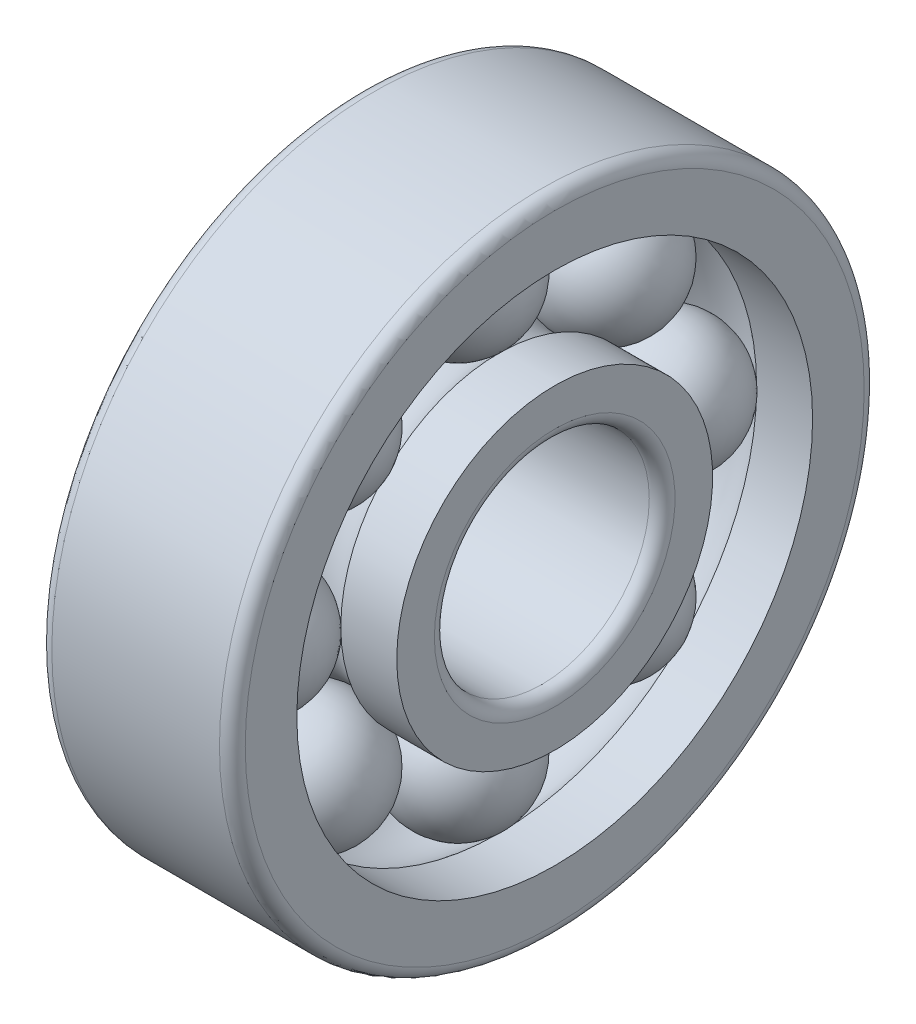
from build123d import *

# Parameters (mm, degrees)
FILLET1_R          = 0.6
FILLET2_R          = 0.6
CIRPATTERN2_COUNT  = 8
CUT_EXTRUDE1_DEPTH = 0.3


with BuildPart() as part:
    # Sketch1 → Revolve1 (revolve)
    with BuildSketch(Plane.XY, mode=Mode.PRIVATE) as revolve1_sk:
        with BuildLine():
            Line((0, 12), (2.604116301, 12))
            ThreePointArc((2.604116301, 12), (4.5, 12.675), (6.395883699, 12))
            Line((6.395883699, 12), (9, 12))
            Line((9, 12), (9, 15))
            Line((9, 15), (0, 15))
            Line((0, 15), (0, 12))
        make_face()
        with BuildLine():
            Line((0, 5), (9, 5))
            Line((9, 5), (9, 7.35))
            Line((9, 7.35), (6.395883699, 7.35))
            ThreePointArc((6.395883699, 7.35), (4.5, 6.675), (2.604116301, 7.35))
            Line((2.604116301, 7.35), (0, 7.35))
            Line((0, 7.35), (0, 5))
        make_face()
    revolve(revolve1_sk.sketch.rotate(Axis((0, 0, 0), (1, 0, 0)), 90), axis=Axis((0, 0, 0), (1, 0, 0)))

    # Fillet1
    fillet1_edges = [part.edges().sort_by_distance(p)[0] for p in [
        (0, 0, -15),
        (9, 0, -15),
    ]]
    fillet(fillet1_edges, radius=FILLET1_R)

    # Fillet2
    fillet2_edges = [part.edges().sort_by_distance(p)[0] for p in [
        (9, 0, -5),
        (0, 0, -5),
    ]]
    fillet(fillet2_edges, radius=FILLET2_R)

    # Sketch3 → Cut-Extrude1 (cut)
    # profile 1 of 7: a face of its own
    with BuildSketch(Plane.ZY):
        Polygon((-3.719151818, 11.718675946), (-4.129764642, 13.169061498), (-3.327410746, 13.396131303), (-3.279013831, 13.224763608), (-3.924001655, 13.042133738), (-3.796769513, 12.593168641), (-3.238835259, 12.751143478), (-3.190438344, 12.580080167), (-3.748372597, 12.422105329), (-3.561785746, 11.763115881), align=None)
    # profile 2 of 7: a face of its own
    with BuildSketch(Plane.ZY):
        Polygon((-2.850834983, 11.965266385), (-2.664248133, 13.531317521), (-2.491967289, 13.563886515), (-1.716399107, 12.179552099), (-1.899942126, 12.144852424), (-2.125794399, 12.566118658), (-2.631983522, 12.470237976), (-2.680380438, 11.997530995), align=None)
        with BuildLine():
            Line((-2.615546834, 12.638257456), (-2.205238392, 12.715875151))
            Line((-2.205238392, 12.715875151), (-2.408566315, 13.10152856))
            add(Edge.make_bspline(
                [(-2.408566315, 13.10152856), (-2.416215139, 13.115915535), (-2.431149278, 13.144005744), (-2.452328841, 13.185420297), (-2.472416903, 13.224685888), (-2.49142099, 13.26180545), (-2.5087066, 13.297048483), (-2.524559114, 13.330365638), (-2.539202471, 13.361556616), (-2.548209714, 13.381850383), (-2.552539529, 13.391605671)],
                knots=[0, 0, 0, 0, 1.207278304, 2.357180626, 3.446533966, 4.475345549, 5.447003446, 6.354914621, 7.209201469, 8, 8, 8, 8], degree=3))
            add(Edge.make_bspline(
                [(-2.552539529, 13.391605671), (-2.55216247, 13.367153081), (-2.551408249, 13.318241168), (-2.553416017, 13.244743634), (-2.557518329, 13.171030702), (-2.562310793, 13.121908532), (-2.564714854, 13.097267196)],
                knots=[0, 0, 0, 0, 0.99540698, 1.991088116, 2.992262153, 4, 4, 4, 4], degree=3))
            Line((-2.564714854, 13.097267196), (-2.615546834, 12.638257456))
        make_face(mode=Mode.SUBTRACT)
    # profile 3 of 7: a face of its own
    with BuildSketch(Plane.ZY):
        with BuildLine():
            Line((-1.053862581, 12.831370346), (-1.069081736, 13.007912554))
            Line((-1.069081736, 13.007912554), (-0.546151542, 13.054178788))
            Line((-0.546151542, 13.054178788), (-0.498363392, 12.495331385))
            add(Edge.make_bspline(
                [(-0.498363392, 12.495331385), (-0.516707407, 12.474927442), (-0.552486208, 12.435130883), (-0.610444028, 12.381987937), (-0.669772023, 12.335759629), (-0.73088098, 12.296834431), (-0.79356108, 12.265190888), (-0.857843247, 12.24105905), (-0.923645284, 12.223781215), (-0.968443541, 12.218533179), (-0.990855275, 12.215907684)],
                knots=[0, 0, 0, 0, 1.132945652, 2.209736461, 3.243482532, 4.236513735, 5.198131396, 6.138569381, 7.068760867, 8, 8, 8, 8], degree=3))
            add(Edge.make_bspline(
                [(-0.990855275, 12.215907684), (-1.005762872, 12.214873601), (-1.035253658, 12.212827939), (-1.079089741, 12.21366584), (-1.121918554, 12.216857657), (-1.163838656, 12.223305282), (-1.204799256, 12.232775907), (-1.244869165, 12.244838427), (-1.283678903, 12.260374583), (-1.32172534, 12.278054885), (-1.358243788, 12.299236255), (-1.393328769, 12.322918511), (-1.42661211, 12.349594405), (-1.458323985, 12.378904927), (-1.488519327, 12.41086573), (-1.5168489, 12.445766586), (-1.543636314, 12.483304212), (-1.568974179, 12.523421969), (-1.59199352, 12.566267587), (-1.612762482, 12.611632114), (-1.63135294, 12.659238812), (-1.64709682, 12.709546378), (-1.660791326, 12.762049377), (-1.672008441, 12.817020963), (-1.680932799, 12.874306535), (-1.684738395, 12.913429061), (-1.686675081, 12.93333869)],
                knots=[0, 0, 0, 0, 0.95729573, 1.893759506, 2.806928323, 3.708188722, 4.608885951, 5.499551386, 6.387077985, 7.28589543, 8.186005648, 9.089585416, 9.996458285, 10.916799269, 11.855202595, 12.811879746, 13.795320432, 14.809245548, 15.850818141, 16.909922757, 18.005180354, 19.123928844, 20.286311769, 21.481250689, 22.718197129, 24, 24, 24, 24], degree=3))
            add(Edge.make_bspline(
                [(-1.686675081, 12.93333869), (-1.688222965, 12.953620411), (-1.691261594, 12.993435138), (-1.69184155, 13.052460451), (-1.690664526, 13.109766203), (-1.685872816, 13.165307101), (-1.679140045, 13.219122167), (-1.668929394, 13.27101953), (-1.656234735, 13.321251478), (-1.64073581, 13.369629408), (-1.622756062, 13.415538874), (-1.603496518, 13.459058314), (-1.581583187, 13.499335992), (-1.558478881, 13.537110473), (-1.532850551, 13.571694223), (-1.505927472, 13.603738466), (-1.476932448, 13.632800711), (-1.445899127, 13.658726633), (-1.413302324, 13.682390997), (-1.378564257, 13.702960245), (-1.342120478, 13.721030784), (-1.304033258, 13.736469885), (-1.264245235, 13.7497643), (-1.222590534, 13.759954877), (-1.17916277, 13.767653899), (-1.149564839, 13.770680525), (-1.134524107, 13.77221856)],
                knots=[0, 0, 0, 0, 1.294601443, 2.541411641, 3.756203764, 4.942233883, 6.088750408, 7.207342046, 8.307125532, 9.385705967, 10.438901258, 11.444989272, 12.41314181, 13.355967366, 14.261617054, 15.15071446, 16.018533511, 16.871220098, 17.722731511, 18.580151351, 19.438106304, 20.310146009, 21.194608931, 22.106388259, 23.037726373, 24, 24, 24, 24], degree=3))
            add(Edge.make_bspline(
                [(-1.134524107, 13.77221856), (-1.112511146, 13.7736572), (-1.069671997, 13.77645692), (-1.006984145, 13.771822033), (-0.947909935, 13.761532747), (-0.89284246, 13.743673544), (-0.841722619, 13.719637874), (-0.794129005, 13.690598634), (-0.751324404, 13.654882612), (-0.718533682, 13.621320947), (-0.694845025, 13.590888554), (-0.677294311, 13.566017608), (-0.66140205, 13.538385822), (-0.645763647, 13.508933874), (-0.631229214, 13.477049005), (-0.617157515, 13.443130312), (-0.604448153, 13.406664473), (-0.596700095, 13.38151735), (-0.592722159, 13.368606547)],
                knots=[0, 0, 0, 0, 1.422053721, 2.767441017, 4.045299764, 5.283543409, 6.490384294, 7.684152766, 8.870427914, 10.07904367, 10.70385211, 11.357728979, 12.041602102, 12.759156067, 13.509136586, 14.301911775, 15.128183298, 16, 16, 16, 16], degree=3))
            Line((-0.592722159, 13.368606547), (-0.735782224, 13.306816775))
            add(Edge.make_bspline(
                [(-0.735782224, 13.306816775), (-0.74252249, 13.326392539), (-0.755179969, 13.363153668), (-0.776971267, 13.413699963), (-0.80058525, 13.455808863), (-0.82560757, 13.490785478), (-0.853478569, 13.519333774), (-0.883797752, 13.543814848), (-0.917907605, 13.563937306), (-0.954643668, 13.580760758), (-0.994096826, 13.593204714), (-1.035803498, 13.60077095), (-1.079308552, 13.603933457), (-1.108856617, 13.602293124), (-1.123870698, 13.601459632)],
                knots=[0, 0, 0, 0, 1.39109994, 2.612332539, 3.693169457, 4.630095272, 5.493233254, 6.366411953, 7.241080175, 8.147334979, 9.076762975, 10.012894533, 10.990304031, 12, 12, 12, 12], degree=3))
            add(Edge.make_bspline(
                [(-1.123870698, 13.601459632), (-1.134950204, 13.600286739), (-1.156700328, 13.59798424), (-1.188411243, 13.592101286), (-1.218782835, 13.584590473), (-1.247704575, 13.574710428), (-1.27551766, 13.563312965), (-1.30174904, 13.549410178), (-1.32675764, 13.533970542), (-1.350371875, 13.51645435), (-1.372659405, 13.49699981), (-1.393383071, 13.475177721), (-1.412950978, 13.451465995), (-1.430849295, 13.425377259), (-1.447779985, 13.397345272), (-1.462717677, 13.366836854), (-1.476975396, 13.334459529), (-1.489217541, 13.299805872), (-1.500336975, 13.263323117), (-1.50907243, 13.224963169), (-1.515715412, 13.18480224), (-1.5206267, 13.14295816), (-1.523216445, 13.099364763), (-1.524187418, 13.054076873), (-1.52300309, 13.007043756), (-1.520524558, 12.975132111), (-1.519264366, 12.958906872)],
                knots=[0, 0, 0, 0, 0.942786055, 1.850778535, 2.727735915, 3.588692098, 4.435655085, 5.269275091, 6.098636926, 6.921435733, 7.75523269, 8.599578895, 9.466128674, 10.354783791, 11.275362108, 12.235590699, 13.228004484, 14.268495354, 15.344499938, 16.454949399, 17.59580442, 18.788963309, 20.019555348, 21.29092121, 22.622588986, 24, 24, 24, 24], degree=3))
            add(Edge.make_bspline(
                [(-1.519264366, 12.958906872), (-1.516844762, 12.934514603), (-1.512157125, 12.887258089), (-1.500112673, 12.819272999), (-1.485080746, 12.756243488), (-1.466333503, 12.698243259), (-1.443802104, 12.645370826), (-1.417884154, 12.597446565), (-1.38835931, 12.554524657), (-1.35507718, 12.516964048), (-1.318882169, 12.484760162), (-1.281156145, 12.456639465), (-1.240973816, 12.434056257), (-1.198965727, 12.41636192), (-1.155161612, 12.402971437), (-1.109144372, 12.395274877), (-1.061181198, 12.392033949), (-1.028697526, 12.393923237), (-1.012162094, 12.394884957)],
                knots=[0, 0, 0, 0, 1.37327781, 2.660528319, 3.865878792, 5.002306761, 6.072219692, 7.082382826, 8.050844673, 8.985342787, 9.887269928, 10.761842739, 11.617353689, 12.463287297, 13.312368239, 14.178004376, 15.072534489, 16, 16, 16, 16], degree=3))
            add(Edge.make_bspline(
                [(-1.012162094, 12.394884957), (-0.995965889, 12.396963051), (-0.963205591, 12.401166443), (-0.914451869, 12.414255806), (-0.865954899, 12.433408217), (-0.818277011, 12.45752123), (-0.773122452, 12.485185097), (-0.732558981, 12.515517063), (-0.696594353, 12.546792992), (-0.676863484, 12.570352318), (-0.667296022, 12.58177619)],
                knots=[0, 0, 0, 0, 0.974918878, 1.971982578, 3.006677648, 4.085820288, 5.16102148, 6.166254584, 7.110820335, 8, 8, 8, 8], degree=3))
            Line((-0.667296022, 12.58177619), (-0.691342288, 12.862417424))
            Line((-0.691342288, 12.862417424), (-1.053862581, 12.831370346))
        make_face()
    # profile 4 of 7: a face of its own
    with BuildSketch(Plane.ZY):
        with BuildLine():
            Line((1.016136433, 13.396227441), (0.864553641, 13.38922663))
            add(Edge.make_bspline(
                [(0.864553641, 13.38922663), (0.861776464, 13.407466169), (0.856607312, 13.441415383), (0.844020818, 13.487784737), (0.829282653, 13.52657055), (0.815286776, 13.547792657), (0.80885153, 13.557550493)],
                knots=[0, 0, 0, 0, 1.235720343, 2.300043504, 3.218367113, 4, 4, 4, 4], degree=3))
            add(Edge.make_bspline(
                [(0.80885153, 13.557550493), (0.804133104, 13.563573005), (0.794893507, 13.575366254), (0.778718637, 13.590397971), (0.762443515, 13.60405251), (0.744948195, 13.615126638), (0.726421574, 13.623580498), (0.707340363, 13.630414703), (0.687171772, 13.634755067), (0.673420701, 13.635834584), (0.666400232, 13.636385721)],
                knots=[0, 0, 0, 0, 1.08856885, 2.131629654, 3.1387964, 4.113579353, 5.070941506, 6.035808231, 6.997201859, 8, 8, 8, 8], degree=3))
            add(Edge.make_bspline(
                [(0.666400232, 13.636385721), (0.655508626, 13.636496852), (0.634020769, 13.636716101), (0.602583818, 13.629806062), (0.572455445, 13.618520461), (0.543977425, 13.601433527), (0.517008523, 13.579103518), (0.491298392, 13.551750335), (0.467312522, 13.51901532), (0.453300106, 13.494689816), (0.446026855, 13.48206348)],
                knots=[0, 0, 0, 0, 0.91520717, 1.805596164, 2.693230502, 3.61702389, 4.589168061, 5.635519124, 6.772698361, 8, 8, 8, 8], degree=3))
            add(Edge.make_bspline(
                [(0.446026855, 13.48206348), (0.439801596, 13.46989317), (0.426886298, 13.44464391), (0.411559707, 13.403125844), (0.396884394, 13.357781918), (0.38553967, 13.307661583), (0.374958497, 13.253514088), (0.367014555, 13.194955861), (0.360523386, 13.132121357), (0.357896116, 13.088712105), (0.356538219, 13.066276143)],
                knots=[0, 0, 0, 0, 0.764994231, 1.587103104, 2.474951852, 3.432904872, 4.462713843, 5.564528612, 6.741232782, 8, 8, 8, 8], degree=3))
            add(Edge.make_bspline(
                [(0.356538219, 13.066276143), (0.366248347, 13.081527133), (0.385091445, 13.111122613), (0.418190955, 13.150544554), (0.454711672, 13.18348133), (0.494103916, 13.209936715), (0.535301826, 13.230592939), (0.577760913, 13.244551555), (0.621130896, 13.252744089), (0.65023346, 13.252620701), (0.664878316, 13.25255861)],
                knots=[0, 0, 0, 0, 1.14456149, 2.221091646, 3.249771039, 4.249938326, 5.218711404, 6.159857954, 7.074012274, 8, 8, 8, 8], degree=3))
            add(Edge.make_bspline(
                [(0.664878316, 13.25255861), (0.676891733, 13.251647608), (0.700748276, 13.249838516), (0.735640526, 13.241723587), (0.769079821, 13.229372343), (0.801183594, 13.213187594), (0.831909816, 13.19284174), (0.861126672, 13.168370605), (0.888974185, 13.13975066), (0.915231442, 13.107415626), (0.939206347, 13.071780537), (0.959752608, 13.032999827), (0.9767455, 12.991606476), (0.99015672, 12.947576301), (0.999838848, 12.90090133), (1.006166205, 12.851659926), (1.00899293, 12.799658761), (1.00787986, 12.764226799), (1.007309323, 12.746065104)],
                knots=[0, 0, 0, 0, 0.850098493, 1.688146874, 2.520320832, 3.363319623, 4.222075637, 5.117724887, 6.050295113, 7.038701374, 8.056477314, 9.07928804, 10.133435589, 11.212625764, 12.32592966, 13.496740325, 14.716880564, 16, 16, 16, 16], degree=3))
            add(Edge.make_bspline(
                [(1.007309323, 12.746065104), (1.005488943, 12.721449123), (1.001920904, 12.673200522), (0.987936644, 12.603111819), (0.967561176, 12.536852735), (0.944898456, 12.484983797), (0.924022393, 12.446141549), (0.907680414, 12.41903377), (0.890311908, 12.394010191), (0.872053292, 12.371083506), (0.852743635, 12.350311338), (0.832717161, 12.331365931), (0.811656801, 12.31453395), (0.782665732, 12.295331675), (0.744936253, 12.275602645), (0.697027637, 12.259796849), (0.647397643, 12.250374819), (0.613680681, 12.25068003), (0.596696498, 12.250833772)],
                knots=[0, 0, 0, 0, 1.652352476, 3.238696648, 4.775917503, 6.288780244, 7.021688875, 7.729291137, 8.408100128, 9.060956826, 9.691053347, 10.306572545, 10.906352401, 11.494542344, 12.634580908, 13.745867391, 14.864529933, 16, 16, 16, 16], degree=3))
            add(Edge.make_bspline(
                [(0.596696498, 12.250833772), (0.581430184, 12.252099915), (0.551432905, 12.254587801), (0.507771148, 12.264410502), (0.466582059, 12.279821606), (0.427743786, 12.300468127), (0.39080708, 12.325811108), (0.356750995, 12.356903635), (0.324844284, 12.392927339), (0.295176231, 12.434093799), (0.268698058, 12.481526777), (0.246649625, 12.535727325), (0.22887986, 12.596766338), (0.215014159, 12.664458457), (0.20543199, 12.739031979), (0.200265086, 12.820351321), (0.198693762, 12.908521504), (0.200811901, 12.969486422), (0.201911595, 13.001138156)],
                knots=[0, 0, 0, 0, 0.773720624, 1.520308947, 2.253887403, 2.990364895, 3.73873054, 4.512264137, 5.315168032, 6.167793081, 7.072483885, 8.054504476, 9.119098783, 10.281932914, 11.544135728, 12.916698277, 14.399213091, 16, 16, 16, 16], degree=3))
            add(Edge.make_bspline(
                [(0.201911595, 13.001138156), (0.203962647, 13.03626442), (0.207911219, 13.103887589), (0.218140896, 13.201121608), (0.232130429, 13.290307446), (0.24914175, 13.371623591), (0.269940537, 13.44497238), (0.294568766, 13.510160695), (0.322377318, 13.567552788), (0.353966219, 13.617038733), (0.388335523, 13.659378227), (0.424706668, 13.695575718), (0.462941205, 13.72599126), (0.503066443, 13.750769442), (0.545463124, 13.769114635), (0.589664114, 13.781623546), (0.635732237, 13.788702886), (0.666986073, 13.788215631), (0.68283692, 13.787968513)],
                knots=[0, 0, 0, 0, 1.641769898, 3.160645949, 4.560184273, 5.852794665, 7.035115412, 8.114032165, 9.100740255, 10.005646554, 10.847118884, 11.640562353, 12.39551167, 13.122245931, 13.834697501, 14.54356901, 15.261349388, 16, 16, 16, 16], degree=3))
            add(Edge.make_bspline(
                [(0.68283692, 13.787968513), (0.69432746, 13.787181064), (0.71694335, 13.785631194), (0.749987917, 13.779428189), (0.781435703, 13.770221019), (0.81143153, 13.758454843), (0.839666484, 13.74336097), (0.866185665, 13.725273638), (0.891332491, 13.704460431), (0.914737611, 13.680747013), (0.936032484, 13.65422255), (0.955062676, 13.625098834), (0.971414555, 13.593323135), (0.985574331, 13.558935125), (0.996893284, 13.521896692), (1.006191407, 13.482375698), (1.012422975, 13.440202724), (1.014875627, 13.411158077), (1.016136433, 13.396227441)],
                knots=[0, 0, 0, 0, 0.969398043, 1.907986919, 2.824731884, 3.72605342, 4.616780393, 5.515058629, 6.425368814, 7.361971668, 8.316185155, 9.285583199, 10.286957947, 11.321615717, 12.413549328, 13.545316031, 14.738149849, 16, 16, 16, 16], degree=3))
        make_face()
        with BuildLine():
            add(Edge.make_bspline(
                [(0.366278479, 12.776199032), (0.365899701, 12.762907592), (0.365159121, 12.736920358), (0.367027289, 12.698878854), (0.371250727, 12.662766151), (0.377876642, 12.628415961), (0.387303662, 12.595939282), (0.39912971, 12.565326386), (0.413664625, 12.536781045), (0.430106266, 12.510164495), (0.448810841, 12.486311686), (0.468062304, 12.464708388), (0.488938833, 12.446819654), (0.510341211, 12.431631703), (0.53273182, 12.419643588), (0.556046611, 12.410769017), (0.580288089, 12.404783031), (0.596867006, 12.40341177), (0.605219225, 12.402720948)],
                knots=[0, 0, 0, 0, 1.298929756, 2.539648966, 3.717746129, 4.849371398, 5.953830535, 7.017995238, 8.051086482, 9.079935033, 10.069483409, 11.009831149, 11.902397009, 12.749536516, 13.570094069, 14.37657542, 15.18214215, 16, 16, 16, 16], degree=3))
            add(Edge.make_bspline(
                [(0.605219225, 12.402720948), (0.612637542, 12.402602987), (0.627356328, 12.402368941), (0.649197524, 12.405900046), (0.670485585, 12.412375089), (0.691239835, 12.422002701), (0.711668442, 12.434205149), (0.731741875, 12.449331387), (0.751015692, 12.467681223), (0.769921428, 12.48861133), (0.787448856, 12.512188429), (0.803126643, 12.538253875), (0.816329215, 12.566726427), (0.828158162, 12.597222145), (0.836996603, 12.630352812), (0.844463414, 12.6655677), (0.849155859, 12.703151232), (0.850883948, 12.728908281), (0.85176955, 12.742108123)],
                knots=[0, 0, 0, 0, 0.767086487, 1.521987013, 2.279806732, 3.065028475, 3.884914936, 4.740191248, 5.661941483, 6.636608266, 7.657902006, 8.699425589, 9.780426746, 10.904435394, 12.082162557, 13.326793276, 14.630048512, 16, 16, 16, 16], degree=3))
            add(Edge.make_bspline(
                [(0.85176955, 12.742108123), (0.852128971, 12.755094999), (0.852828405, 12.78036751), (0.85125362, 12.817271208), (0.847706857, 12.852172558), (0.84180914, 12.884912223), (0.833062199, 12.915382409), (0.822587726, 12.943837197), (0.80938231, 12.970081238), (0.794233661, 12.994183434), (0.777187298, 13.015618598), (0.759211026, 13.034747494), (0.739924772, 13.051020906), (0.719455228, 13.064442926), (0.697940261, 13.075294088), (0.675312886, 13.08314892), (0.651616671, 13.088532365), (0.635381203, 13.089719456), (0.62713481, 13.090322409)],
                knots=[0, 0, 0, 0, 1.346714411, 2.620711308, 3.826608302, 4.982077025, 6.064402701, 7.109746365, 8.121246599, 9.104789006, 10.056071553, 10.956431868, 11.822522443, 12.665758358, 13.489072502, 14.314199302, 15.143740365, 16, 16, 16, 16], degree=3))
            add(Edge.make_bspline(
                [(0.62713481, 13.090322409), (0.619014344, 13.090380399), (0.602924515, 13.090495299), (0.579044665, 13.087871743), (0.555931069, 13.081809145), (0.533302833, 13.073470077), (0.511701751, 13.061550877), (0.490398715, 13.047568188), (0.470098365, 13.030297081), (0.450364067, 13.010710974), (0.432226249, 12.988573509), (0.415963194, 12.964351089), (0.401874845, 12.938092635), (0.390377479, 12.909562051), (0.380978399, 12.879102221), (0.373715827, 12.846636462), (0.368392178, 12.812167712), (0.366995085, 12.788393474), (0.366278479, 12.776199032)],
                knots=[0, 0, 0, 0, 0.857217353, 1.698483825, 2.527447303, 3.375170773, 4.237994403, 5.126513063, 6.062106064, 7.047013452, 8.059451486, 9.078726387, 10.123694315, 11.20010296, 12.321842761, 13.486313982, 14.710663381, 16, 16, 16, 16], degree=3))
        make_face(mode=Mode.SUBTRACT)
    # profile 5 of 7: a face of its own
    with BuildSketch(Plane.ZY):
        with BuildLine():
            Line((1.93990265, 12.321698821), (1.917682682, 12.14576538))
            Line((1.917682682, 12.14576538), (1.108632357, 12.248038107))
            add(Edge.make_bspline(
                [(1.108632357, 12.248038107), (1.109685982, 12.257094832), (1.111821272, 12.275449319), (1.118193383, 12.303094171), (1.126687113, 12.331240937), (1.1374246, 12.359882297), (1.150206, 12.389065442), (1.165912069, 12.418456716), (1.183622146, 12.448583227), (1.203344058, 12.479700422), (1.226851974, 12.511059575), (1.253354741, 12.543833308), (1.283838408, 12.57746142), (1.318002578, 12.612137835), (1.355800498, 12.647859544), (1.397645943, 12.684125021), (1.44269921, 12.722132388), (1.474522879, 12.74712124), (1.490937552, 12.76001051)],
                knots=[0, 0, 0, 0, 0.667006299, 1.351764453, 2.073125466, 2.81811183, 3.589580593, 4.403533452, 5.255726881, 6.147800535, 7.098516906, 8.122776808, 9.232423117, 10.41938889, 11.685619806, 13.038296286, 14.472350933, 16, 16, 16, 16], degree=3))
            add(Edge.make_bspline(
                [(1.490937552, 12.76001051), (1.509952824, 12.77487153), (1.54647244, 12.803412736), (1.598483569, 12.845443749), (1.645274626, 12.885451456), (1.687656401, 12.922499979), (1.724570732, 12.957781579), (1.756908114, 12.99020881), (1.784478603, 13.020174568), (1.813608216, 13.056582096), (1.843161878, 13.10015957), (1.870924734, 13.15205149), (1.890765303, 13.203241348), (1.896799803, 13.237858065), (1.899724078, 13.254633075)],
                knots=[0, 0, 0, 0, 1.321793623, 2.538559408, 3.662075673, 4.693493111, 5.62112821, 6.458096971, 7.201592742, 7.84988214, 9.010455856, 10.079364818, 11.06927416, 12, 12, 12, 12], degree=3))
            add(Edge.make_bspline(
                [(1.899724078, 13.254633075), (1.900677157, 13.263957158), (1.902538507, 13.282166974), (1.90289715, 13.309162238), (1.900742239, 13.335032617), (1.896456818, 13.359882003), (1.890137677, 13.383803896), (1.881216649, 13.406588187), (1.870330744, 13.428456502), (1.856686547, 13.448609922), (1.842210759, 13.467879539), (1.825428435, 13.484454148), (1.808229764, 13.499775905), (1.789040385, 13.512117362), (1.768960385, 13.52289801), (1.747559766, 13.531504458), (1.724824694, 13.537538721), (1.709205628, 13.54007351), (1.701266286, 13.541361971)],
                knots=[0, 0, 0, 0, 1.153277568, 2.252336449, 3.317452421, 4.344019205, 5.352808598, 6.357026823, 7.351177248, 8.352206606, 9.348942195, 10.311529268, 11.250245813, 12.178520249, 13.1114872, 14.053023966, 15.010330763, 16, 16, 16, 16], degree=3))
            add(Edge.make_bspline(
                [(1.701266286, 13.541361971), (1.692653513, 13.542262567), (1.675757517, 13.5440293), (1.65061213, 13.54339265), (1.626500332, 13.539873312), (1.603128681, 13.534583168), (1.58069352, 13.526163442), (1.559128768, 13.515272306), (1.538574111, 13.501579146), (1.518807097, 13.485916141), (1.500367163, 13.467561478), (1.484059676, 13.44644752), (1.469400689, 13.423201262), (1.456461781, 13.397661196), (1.445676428, 13.369668683), (1.436524944, 13.339352189), (1.429183028, 13.306696008), (1.425944965, 13.283982655), (1.42427765, 13.272287295)],
                knots=[0, 0, 0, 0, 0.954475003, 1.872428969, 2.765065679, 3.639128864, 4.510177781, 5.40105892, 6.29810443, 7.229669491, 8.179277041, 9.159835931, 10.1658026, 11.206827848, 12.312440041, 13.470124206, 14.697338637, 16, 16, 16, 16], degree=3))
            Line((1.42427765, 13.272287295), (1.272086091, 13.310943951))
            add(Edge.make_bspline(
                [(1.272086091, 13.310943951), (1.275768195, 13.328161289), (1.282915352, 13.361581043), (1.297892958, 13.409232801), (1.314395583, 13.453361772), (1.333308106, 13.494004033), (1.354863524, 13.530759463), (1.378704291, 13.563981195), (1.404982642, 13.593433076), (1.433697715, 13.618990771), (1.464255234, 13.641115935), (1.496800787, 13.659399875), (1.530866069, 13.674485896), (1.56676936, 13.685383999), (1.604194545, 13.692755947), (1.643245146, 13.696286997), (1.684014247, 13.696388724), (1.711530033, 13.693506955), (1.725616935, 13.692031614)],
                knots=[0, 0, 0, 0, 1.272296909, 2.469594832, 3.607202888, 4.676992668, 5.706121469, 6.683380807, 7.628847164, 8.553597286, 9.457513582, 10.351011472, 11.247785616, 12.145759058, 13.057853614, 14.000926526, 14.976560151, 16, 16, 16, 16], degree=3))
            add(Edge.make_bspline(
                [(1.725616935, 13.692031614), (1.740688126, 13.68978603), (1.770105291, 13.68540292), (1.812179132, 13.674137383), (1.850786292, 13.659100998), (1.886291828, 13.640933357), (1.918020615, 13.618348137), (1.946960098, 13.59283204), (1.972123074, 13.563225873), (1.993406014, 13.530302152), (2.011804207, 13.495603283), (2.027050889, 13.459819614), (2.039360571, 13.423405764), (2.048432098, 13.38622887), (2.054672526, 13.348379351), (2.057231693, 13.30977657), (2.057181966, 13.270462002), (2.054289263, 13.244167062), (2.052828786, 13.230891191)],
                knots=[0, 0, 0, 0, 1.15040364, 2.245450509, 3.281622254, 4.275783492, 5.249647498, 6.215850912, 7.183512381, 8.174121975, 9.171851653, 10.147041793, 11.109254691, 12.072169411, 13.034840078, 14.003017414, 14.991757288, 16, 16, 16, 16], degree=3))
            add(Edge.make_bspline(
                [(2.052828786, 13.230891191), (2.051055094, 13.219093422), (2.047517043, 13.195559951), (2.039484217, 13.16090823), (2.029496837, 13.126751092), (2.016641396, 13.093474276), (2.001644126, 13.06077175), (1.984591354, 13.028676962), (1.965031715, 12.997281191), (1.942753041, 12.966086499), (1.916966675, 12.934241584), (1.886932653, 12.900787586), (1.852657573, 12.865017521), (1.81370431, 12.827018836), (1.769953461, 12.787155613), (1.721709912, 12.744788979), (1.669232231, 12.700010641), (1.632145652, 12.670125698), (1.612995182, 12.654693951)],
                knots=[0, 0, 0, 0, 0.769001059, 1.533956406, 2.29154678, 3.061854649, 3.831773487, 4.610288552, 5.40361617, 6.215079333, 7.080474102, 8.044280821, 9.113135721, 10.274343138, 11.552323683, 12.929052439, 14.414248675, 16, 16, 16, 16], degree=3))
            add(Edge.make_bspline(
                [(1.612995182, 12.654693951), (1.600934068, 12.64503943), (1.57782621, 12.626542357), (1.544558187, 12.600320987), (1.515214103, 12.575824829), (1.488810286, 12.554163441), (1.465676883, 12.534796221), (1.446082211, 12.517542796), (1.429674997, 12.502799755), (1.405207116, 12.479457629), (1.373743069, 12.445880022), (1.350782525, 12.413282362), (1.339659143, 12.397490217)],
                knots=[0, 0, 0, 0, 1.229633073, 2.355850965, 3.371198735, 4.271774876, 5.074127345, 5.772261952, 6.349693511, 6.829482164, 8.464022347, 10, 10, 10, 10], degree=3))
            Line((1.339659143, 12.397490217), (1.93990265, 12.321698821))
        make_face()
    # profile 6 of 7: a face of its own
    with BuildSketch(Plane.ZY):
        with BuildLine():
            add(Edge.make_bspline(
                [(2.224108345, 12.850186045), (2.230586077, 12.880167783), (2.243155318, 12.938343651), (2.265015067, 13.022068999), (2.288917008, 13.09952758), (2.315132593, 13.170613841), (2.342989709, 13.235532916), (2.37266347, 13.294303227), (2.404748753, 13.346542203), (2.438380991, 13.392899023), (2.474315849, 13.432582148), (2.5118862, 13.466006625), (2.551563113, 13.492436799), (2.592897789, 13.512745768), (2.636401555, 13.525330219), (2.681318499, 13.532374311), (2.728156018, 13.531948072), (2.759364967, 13.526751355), (2.77534617, 13.524090266)],
                knots=[0, 0, 0, 0, 1.51762586, 2.944766033, 4.280197086, 5.527082514, 6.691908515, 7.774124029, 8.781533454, 9.722396442, 10.603813119, 11.425577734, 12.20393126, 12.956151366, 13.694762007, 14.436012529, 15.199127109, 16, 16, 16, 16], degree=3))
            add(Edge.make_bspline(
                [(2.77534617, 13.524090266), (2.789364262, 13.520820952), (2.816834299, 13.514414362), (2.855453944, 13.498408123), (2.891149618, 13.478827392), (2.923022363, 13.453950874), (2.951913413, 13.425317557), (2.976965581, 13.391831381), (2.999111596, 13.354321091), (3.010551891, 13.326905169), (3.016417598, 13.312848383)],
                knots=[0, 0, 0, 0, 1.027583023, 2.013665107, 2.978272866, 3.930111801, 4.894474026, 5.878178363, 6.91209226, 8, 8, 8, 8], degree=3))
            add(Edge.make_bspline(
                [(3.016417598, 13.312848383), (3.022800705, 13.294191943), (3.036069233, 13.255410908), (3.04876881, 13.192476581), (3.056097723, 13.123513894), (3.058468183, 13.048322513), (3.054974563, 12.966926383), (3.047109287, 12.879232588), (3.033567479, 12.785395406), (3.021062141, 12.721178596), (3.0145913, 12.687949844)],
                knots=[0, 0, 0, 0, 0.747472858, 1.553767569, 2.42903278, 3.376479573, 4.404983241, 5.518111676, 6.715756038, 8, 8, 8, 8], degree=3))
            add(Edge.make_bspline(
                [(3.0145913, 12.687949844), (3.008119578, 12.658068253), (2.995583838, 12.600187535), (2.973677495, 12.51687396), (2.949624746, 12.439817709), (2.924025005, 12.368743874), (2.895931944, 12.304053831), (2.866254072, 12.245310906), (2.834365982, 12.192838193), (2.800588517, 12.146575071), (2.765002972, 12.106668551), (2.727404415, 12.073371162), (2.687759275, 12.046874789), (2.646346674, 12.026733149), (2.602901785, 12.013478664), (2.557743457, 12.007134577), (2.51075635, 12.007377796), (2.479438747, 12.012587407), (2.463353475, 12.015263155)],
                knots=[0, 0, 0, 0, 1.514067377, 2.932752412, 4.264569475, 5.510828725, 6.672075626, 7.75525006, 8.767837551, 9.70953421, 10.588362544, 11.410855301, 12.189898503, 12.94278513, 13.683500359, 14.42964961, 15.193440364, 16, 16, 16, 16], degree=3))
            add(Edge.make_bspline(
                [(2.463353475, 12.015263155), (2.449329424, 12.018619749), (2.421576214, 12.025262355), (2.382559152, 12.042046268), (2.346439956, 12.063292428), (2.313216336, 12.089261955), (2.283706769, 12.120748871), (2.256949755, 12.156799109), (2.233350672, 12.197669362), (2.212634075, 12.243606043), (2.195997015, 12.295571467), (2.185179928, 12.354465663), (2.178893867, 12.420241967), (2.177957351, 12.492893016), (2.182211746, 12.572452224), (2.191243198, 12.658865908), (2.204869225, 12.752431064), (2.21752879, 12.81675498), (2.224108345, 12.850186045)],
                knots=[0, 0, 0, 0, 0.714242139, 1.413465542, 2.097118168, 2.788856408, 3.497311654, 4.231146791, 5.01152392, 5.833788509, 6.726752545, 7.710891652, 8.798162113, 10.001246298, 11.31149229, 12.748331305, 14.310010445, 16, 16, 16, 16], degree=3))
        make_face()
        with BuildLine():
            add(Edge.make_bspline(
                [(2.376299904, 12.819138967), (2.370501549, 12.790363222), (2.359384533, 12.735192326), (2.346901035, 12.655527235), (2.33697889, 12.583018225), (2.331612138, 12.517378684), (2.329035609, 12.458659152), (2.330721306, 12.406851398), (2.33588799, 12.36195491), (2.344923815, 12.323509041), (2.357655002, 12.290677221), (2.371466572, 12.261614852), (2.387306415, 12.236031964), (2.40534759, 12.21410977), (2.425695687, 12.196022762), (2.447797464, 12.181134347), (2.472067172, 12.169954589), (2.489341599, 12.165662333), (2.49805315, 12.163497733)],
                knots=[0, 0, 0, 0, 1.922419806, 3.685799379, 5.280814821, 6.714619454, 7.998065375, 9.12852238, 10.106127415, 10.953957146, 11.706878572, 12.408328845, 13.059225476, 13.672712762, 14.261027495, 14.836093533, 15.413038061, 16, 16, 16, 16], degree=3))
            add(Edge.make_bspline(
                [(2.49805315, 12.163497733), (2.506448192, 12.162084169), (2.523170939, 12.159268377), (2.548659471, 12.160353984), (2.573762307, 12.165739865), (2.598566762, 12.174979225), (2.623075871, 12.188282), (2.647320037, 12.205630201), (2.671348912, 12.226996571), (2.695165581, 12.253071737), (2.718803156, 12.285008565), (2.740963754, 12.324649369), (2.762781937, 12.371706943), (2.78389197, 12.426372193), (2.804636664, 12.488600947), (2.824006625, 12.55873491), (2.843763883, 12.636374115), (2.855205408, 12.691046197), (2.861182209, 12.719605688)],
                knots=[0, 0, 0, 0, 0.561328558, 1.118154839, 1.673040388, 2.252144501, 2.861062457, 3.510279762, 4.21793254, 4.981907468, 5.840093324, 6.837153196, 7.976896503, 9.265479668, 10.707153588, 12.309554693, 14.072192721, 16, 16, 16, 16], degree=3))
            add(Edge.make_bspline(
                [(2.861182209, 12.719605688), (2.866974907, 12.748483933), (2.878063104, 12.803761747), (2.89061447, 12.883618482), (2.900482555, 12.956237213), (2.905866164, 13.021973066), (2.908463761, 13.080596879), (2.906698671, 13.132387967), (2.901720223, 13.177230499), (2.892363602, 13.215535031), (2.880347798, 13.248450174), (2.865910516, 13.277206947), (2.849853748, 13.302626797), (2.831832327, 13.324744799), (2.8111535, 13.342719051), (2.788763731, 13.357615228), (2.76410286, 13.368847218), (2.746519145, 13.373093623), (2.737602663, 13.375246922)],
                knots=[0, 0, 0, 0, 1.924832311, 3.684452554, 5.282643724, 6.713391644, 7.9941014, 9.115521105, 10.097623941, 10.937202153, 11.686202853, 12.383135494, 13.036189406, 13.648368805, 14.240389797, 14.819759228, 15.401514697, 16, 16, 16, 16], degree=3))
            add(Edge.make_bspline(
                [(2.737602663, 13.375246922), (2.729202814, 13.37654609), (2.712658798, 13.37910488), (2.687444719, 13.37797467), (2.662477574, 13.373071465), (2.63767065, 13.363878666), (2.613546647, 13.349989739), (2.589242227, 13.332945741), (2.565530535, 13.311317905), (2.541697637, 13.285386074), (2.518120637, 13.253557285), (2.49621082, 13.213942589), (2.474314771, 13.167110339), (2.453692562, 13.112292747), (2.432809579, 13.050157819), (2.413486561, 12.980005389), (2.393715037, 12.902371796), (2.382275609, 12.847698889), (2.376299904, 12.819138967)],
                knots=[0, 0, 0, 0, 0.561709608, 1.10632137, 1.661076055, 2.241443244, 2.849020252, 3.499653556, 4.203835028, 4.969476253, 5.829533886, 6.819600117, 7.961829304, 9.250791091, 10.695609428, 12.301505509, 14.067988005, 16, 16, 16, 16], degree=3))
        make_face(mode=Mode.SUBTRACT)
    # profile 7 of 7: a face of its own
    with BuildSketch(Plane.ZY):
        with BuildLine():
            add(Edge.make_bspline(
                [(3.215012161, 12.639028343), (3.223794641, 12.668430346), (3.240825593, 12.725446596), (3.269632513, 12.806992482), (3.29915184, 12.882473451), (3.33089935, 12.951252986), (3.363631309, 13.013908973), (3.397872689, 13.07012154), (3.433985441, 13.119731977), (3.471219497, 13.163268257), (3.510282233, 13.199913183), (3.550372331, 13.230343011), (3.591992276, 13.253635191), (3.634859194, 13.270455937), (3.679013313, 13.280387315), (3.724467187, 13.282840413), (3.77106772, 13.27948556), (3.801742664, 13.271802227), (3.817386349, 13.267883862)],
                knots=[0, 0, 0, 0, 1.518255756, 2.944195543, 4.278375493, 5.527452853, 6.690814483, 7.774944828, 8.7812094, 9.724436709, 10.605352922, 11.42675482, 12.208967515, 12.957671554, 13.698301937, 14.437740088, 15.20327478, 16, 16, 16, 16], degree=3))
            add(Edge.make_bspline(
                [(3.817386349, 13.267883862), (3.831125647, 13.263479877), (3.8580621, 13.254845686), (3.895382542, 13.235892198), (3.929326654, 13.213327808), (3.959317445, 13.186240678), (3.985740884, 13.155238291), (4.008313553, 13.120043004), (4.027846209, 13.080968248), (4.037011087, 13.052626439), (4.041716706, 13.038074609)],
                knots=[0, 0, 0, 0, 1.028577774, 2.016568481, 2.976848836, 3.930880368, 4.891734229, 5.876187219, 6.909548628, 8, 8, 8, 8], degree=3))
            add(Edge.make_bspline(
                [(4.041716706, 13.038074609), (4.04672945, 13.018987988), (4.057150611, 12.979308178), (4.064376863, 12.915503756), (4.066437396, 12.846184767), (4.062414385, 12.771126026), (4.053174533, 12.690221823), (4.038054674, 12.603581534), (4.017278413, 12.511054279), (3.999697513, 12.448003742), (3.990580342, 12.415306752)],
                knots=[0, 0, 0, 0, 0.747881693, 1.554796084, 2.429034091, 3.377122065, 4.403739355, 5.51692628, 6.712318083, 8, 8, 8, 8], degree=3))
            add(Edge.make_bspline(
                [(3.990580342, 12.415306752), (3.981922681, 12.385999042), (3.965127169, 12.329143274), (3.936273768, 12.247943047), (3.906686194, 12.172843824), (3.875270997, 12.104170223), (3.842671676, 12.041678025), (3.808131395, 11.985667092), (3.77233767, 11.935832184), (3.734978709, 11.892385304), (3.696114195, 11.855576516), (3.656222537, 11.824880952), (3.614504105, 11.801636268), (3.571650031, 11.784751941), (3.527381411, 11.774975209), (3.481830909, 11.771883332), (3.435053812, 11.775924751), (3.404258634, 11.783493738), (3.388510537, 11.787364382)],
                knots=[0, 0, 0, 0, 1.513168682, 2.935485854, 4.266042553, 5.509436495, 6.673710201, 7.754411959, 8.76553128, 9.70949808, 10.587445934, 11.412511541, 12.195337492, 12.944628516, 13.685839553, 14.431194692, 15.197741389, 16, 16, 16, 16], degree=3))
            add(Edge.make_bspline(
                [(3.388510537, 11.787364382), (3.374770384, 11.791870786), (3.347689926, 11.800752457), (3.309883339, 11.820282832), (3.275532404, 11.844419713), (3.244938932, 11.873427683), (3.217491722, 11.906654666), (3.19371871, 11.944786395), (3.173484319, 11.987518188), (3.156383586, 12.034980527), (3.144180532, 12.08826258), (3.137835288, 12.147884788), (3.136882772, 12.213966383), (3.141292954, 12.286497618), (3.151700017, 12.365521889), (3.167377224, 12.45102054), (3.188452035, 12.54312214), (3.205926829, 12.606222035), (3.215012161, 12.639028343)],
                knots=[0, 0, 0, 0, 0.716118855, 1.411398209, 2.100956505, 2.791450219, 3.495538598, 4.232560251, 5.013423124, 5.836147207, 6.729494831, 7.716788856, 8.803698881, 10.003177257, 11.316773916, 12.753616934, 14.312170819, 16, 16, 16, 16], degree=3))
        make_face()
        with BuildLine():
            add(Edge.make_bspline(
                [(3.364464271, 12.59580594), (3.356478303, 12.567544622), (3.341191239, 12.513445654), (3.322013748, 12.43517701), (3.306824846, 12.363541762), (3.296245306, 12.298519716), (3.289011221, 12.240151902), (3.286899182, 12.188451193), (3.288231927, 12.143270194), (3.294275339, 12.1042388), (3.304129868, 12.070482245), (3.31553258, 12.040384446), (3.32944383, 12.013657697), (3.346177583, 11.990605901), (3.364667409, 11.970586137), (3.385672519, 11.954138393), (3.409145249, 11.941532211), (3.425958053, 11.935775051), (3.434472388, 11.932859511)],
                knots=[0, 0, 0, 0, 1.923433571, 3.681914995, 5.277214284, 6.718263669, 7.995961888, 9.126667942, 10.104381706, 10.952207792, 11.70530193, 12.40381537, 13.057822897, 13.671991053, 14.264380365, 14.837328092, 15.411200053, 16, 16, 16, 16], degree=3))
            add(Edge.make_bspline(
                [(3.434472388, 11.932859511), (3.442747257, 11.930863407), (3.459233032, 11.926886627), (3.484681412, 11.925770229), (3.510184958, 11.928873396), (3.535494631, 11.936466777), (3.561118676, 11.947554099), (3.586732274, 11.962850053), (3.61195034, 11.982804336), (3.638170271, 12.006385575), (3.664003296, 12.036564702), (3.689494563, 12.074112079), (3.714811769, 12.119361944), (3.740346425, 12.172100698), (3.765373756, 12.232730702), (3.791006428, 12.300863527), (3.816077292, 12.377009447), (3.831940287, 12.43058298), (3.840215083, 12.458529154)],
                knots=[0, 0, 0, 0, 0.561482428, 1.118624676, 1.672489468, 2.251783636, 2.858371325, 3.513795295, 4.216518477, 4.980539356, 5.840869456, 6.833991363, 7.974985805, 9.2644137, 10.703880782, 12.307878372, 14.07403642, 16, 16, 16, 16], degree=3))
            add(Edge.make_bspline(
                [(3.840215083, 12.458529154), (3.848186706, 12.486894986), (3.863422117, 12.541107922), (3.88277317, 12.619544967), (3.897639218, 12.691350314), (3.909015566, 12.756364179), (3.91538122, 12.814826261), (3.918333382, 12.866490343), (3.91633674, 12.911669322), (3.910405349, 12.950697425), (3.900612939, 12.984523351), (3.888884146, 13.014456851), (3.874730986, 13.041044519), (3.858418798, 13.064412591), (3.839153839, 13.084148621), (3.817844849, 13.100710294), (3.794008584, 13.11384247), (3.776809404, 13.119510641), (3.768076284, 13.122388732)],
                knots=[0, 0, 0, 0, 1.923631604, 3.676455475, 5.273107521, 6.710604683, 7.983451197, 9.110811395, 10.085672185, 10.930770565, 11.681441777, 12.380130024, 13.026184812, 13.643764903, 14.234025346, 14.819658566, 15.400665472, 16, 16, 16, 16], degree=3))
            add(Edge.make_bspline(
                [(3.768076284, 13.122388732), (3.759904845, 13.124420999), (3.743632052, 13.128468101), (3.718365611, 13.129052866), (3.693069356, 13.126125951), (3.667815717, 13.118463307), (3.642470544, 13.107099925), (3.616990968, 13.091702696), (3.591721717, 13.071840396), (3.565696487, 13.048025138), (3.540093017, 13.0176691), (3.514534761, 12.980308872), (3.489570672, 12.934952394), (3.464399585, 12.882014164), (3.438885294, 12.82152699), (3.413857789, 12.753163019), (3.388500492, 12.677259955), (3.372713588, 12.623761251), (3.364464271, 12.59580594)],
                knots=[0, 0, 0, 0, 0.555926475, 1.107084809, 1.661955238, 2.235851639, 2.846244591, 3.497095837, 4.201094934, 4.971057753, 5.828567821, 6.823492911, 7.963258471, 9.252107854, 10.702984454, 12.307548225, 14.070539502, 16, 16, 16, 16], degree=3))
        make_face(mode=Mode.SUBTRACT)
    extrude(amount=-CUT_EXTRUDE1_DEPTH, mode=Mode.SUBTRACT)


with BuildPart() as body_2:
    # Sketch2 → Revolve2 (revolve)
    with BuildSketch(Plane.XY):
        with BuildLine():
            Line((4.5, 12.675), (4.5, 6.675))
            ThreePointArc((4.5, 6.675), (1.5, 9.675), (4.5, 12.675))
        make_face()
    revolve(axis=Axis((4.5, 12.675, 0), (0, -1, 0)))


with BuildPart() as cirpattern2_1:
    # CirPattern2: pattern copy
    add(body_2.part.rotate(Axis((0, 0, 0), (1, 0, 0)), 1 * 360 / CIRPATTERN2_COUNT))


with BuildPart() as cirpattern2_2:
    # CirPattern2: pattern copy
    add(body_2.part.rotate(Axis((0, 0, 0), (1, 0, 0)), 2 * 360 / CIRPATTERN2_COUNT))


with BuildPart() as cirpattern2_3:
    # CirPattern2: pattern copy
    add(body_2.part.rotate(Axis((0, 0, 0), (1, 0, 0)), 3 * 360 / CIRPATTERN2_COUNT))


with BuildPart() as cirpattern2_4:
    # CirPattern2: pattern copy
    add(body_2.part.rotate(Axis((0, 0, 0), (1, 0, 0)), 4 * 360 / CIRPATTERN2_COUNT))


with BuildPart() as cirpattern2_5:
    # CirPattern2: pattern copy
    add(body_2.part.rotate(Axis((0, 0, 0), (1, 0, 0)), 5 * 360 / CIRPATTERN2_COUNT))


with BuildPart() as cirpattern2_6:
    # CirPattern2: pattern copy
    add(body_2.part.rotate(Axis((0, 0, 0), (1, 0, 0)), 6 * 360 / CIRPATTERN2_COUNT))


with BuildPart() as cirpattern2_7:
    # CirPattern2: pattern copy
    add(body_2.part.rotate(Axis((0, 0, 0), (1, 0, 0)), 7 * 360 / CIRPATTERN2_COUNT))


solid = Compound([part.part, body_2.part, cirpattern2_1.part, cirpattern2_2.part, cirpattern2_3.part, cirpattern2_4.part, cirpattern2_5.part, cirpattern2_6.part, cirpattern2_7.part])
